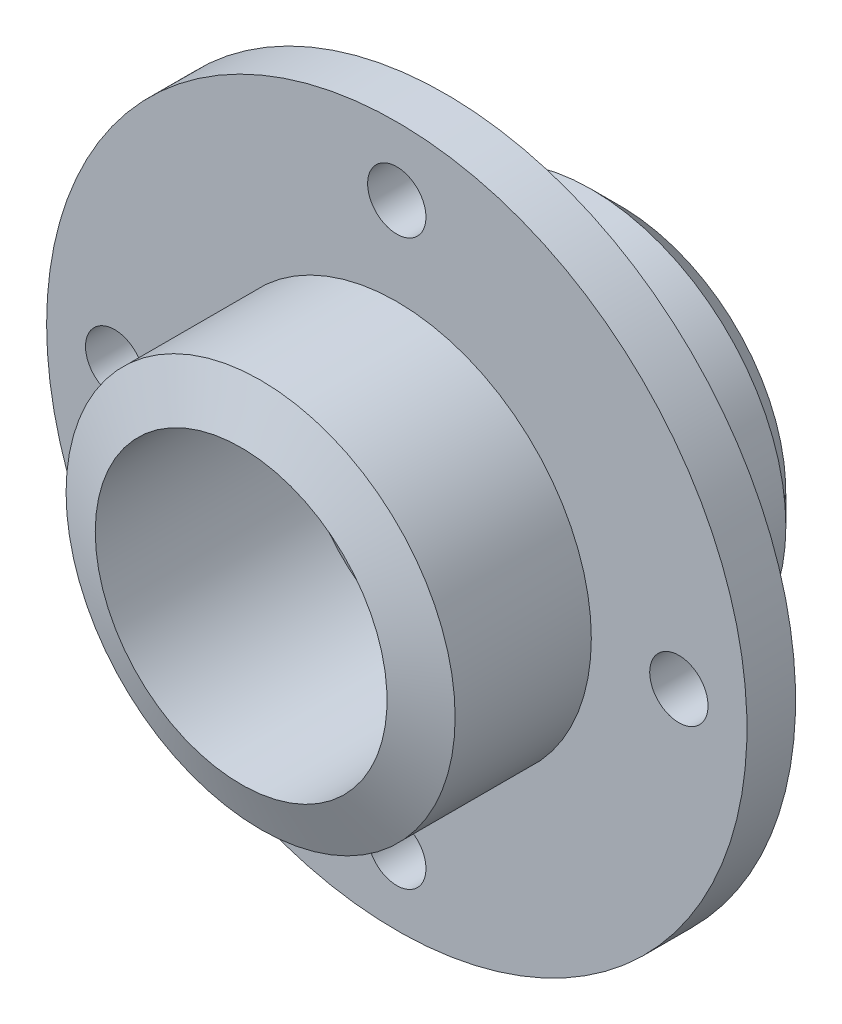
from build123d import *

# Parameters (mm, degrees)
SKETCH2_R          = 6
CUT_EXTRUDE1_DEPTH = 10
CUT_EXTRUDE2_DEPTH = 6


with BuildPart() as part:
    # Sketch1 → Revolve2 (revolve)
    with BuildSketch(Plane(origin=(0, 0, 0), x_dir=(1, 0, 0), z_dir=(0, 1, 0)), mode=Mode.PRIVATE) as revolve2_sk:
        with BuildLine():
            ThreePointArc((31, 42), (33.121320344, 42.878679656), (34, 45))
            Line((34, 45), (34, 72))
            Line((34, 72), (0, 72))
            Line((0, 72), (0, 78))
            Line((0, 78), (34, 78))
            Line((34, 78), (40, 72))
            Line((40, 72), (40, 42))
            Line((40, 42), (72, 42))
            Line((72, 42), (72, 32))
            Line((72, 32), (40, 32))
            Line((40, 32), (40, 4))
            Line((40, 4), (30, 0))
            Line((30, 0), (30, 42))
            Line((30, 42), (31, 42))
        make_face()
    revolve(revolve2_sk.sketch.rotate(Axis((0, 0, -115.849307743), (0, 0, 1)), 180), axis=Axis((0, 0, -115.849307743), (0, 0, 1)))

    # Sketch2 → Cut-Extrude1 (cut)
    with BuildSketch(Plane(origin=(0, 0, -42), x_dir=(-1, 0, 0), z_dir=(0, 0, -1))):
        with Locations((58, 0)):
            Circle(SKETCH2_R)
        with Locations((0, -58)):
            Circle(SKETCH2_R)
        with Locations((-58, 0)):
            Circle(SKETCH2_R)
        with Locations((0, 58)):
            Circle(SKETCH2_R)
    extrude(amount=-CUT_EXTRUDE1_DEPTH, mode=Mode.SUBTRACT)

    # Sketch3 → Cut-Extrude2 (cut)
    with BuildSketch(Plane(origin=(0, 0, -78), x_dir=(-1, 0, 0), z_dir=(0, 0, -1))):
        with BuildLine():
            Line((-6, 32), (6, 32))
            Line((6, 32), (6, 23.237900077))
            ThreePointArc((6, 23.237900077), (0, -24), (-6, 23.237900077))
            Line((-6, 23.237900077), (-6, 32))
        make_face()
    extrude(amount=-CUT_EXTRUDE2_DEPTH, mode=Mode.SUBTRACT)


solid = part.part
